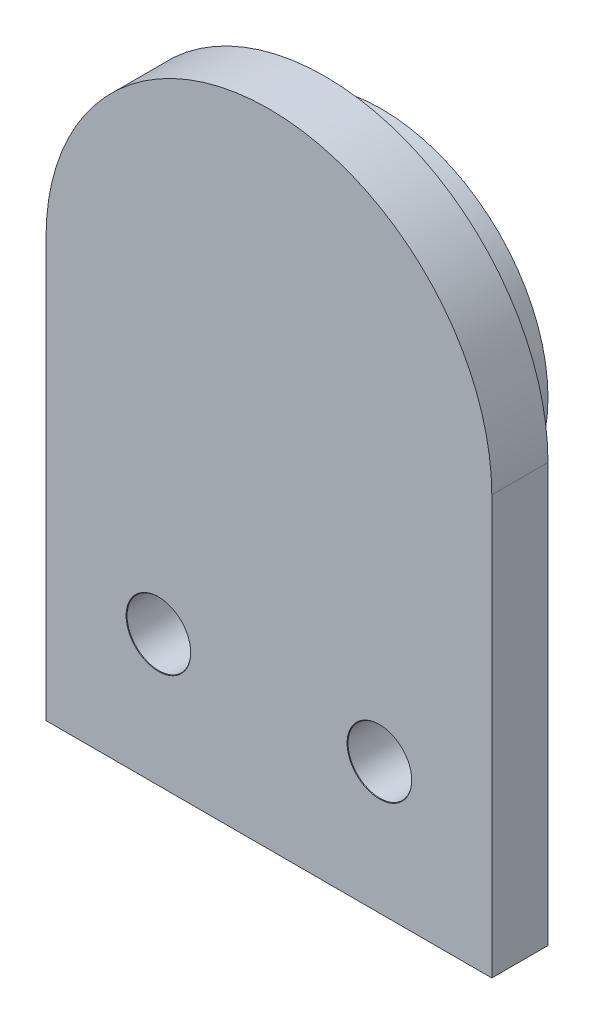
from build123d import *

# Parameters (mm, degrees)
BOSS_EXTRUDE1_DEPTH            = 3
SKETCH2_R                      = 8.9
BOSS_EXTRUDE2_DEPTH            = 3
SKETCH3_R                      = 2
BOSS_EXTRUDE3_DEPTH            = 3
M3_CLEARANCE_HOLE1_D           = 3.4
M3_CLEARANCE_HOLE1_CSINK_D     = 3.45
M3_CLEARANCE_HOLE1_CSINK_ANGLE = 90


with BuildPart() as part:
    # Sketch1 → Boss-Extrude1 (new body)
    with BuildSketch(Plane.XY):
        with BuildLine():
            Line((-11.9, 0), (-11.9, -22.34))
            Line((-11.9, -22.34), (11.9, -22.34))
            Line((11.9, -22.34), (11.9, 0))
            ThreePointArc((11.9, 0), (0, 11.9), (-11.9, 0))
        make_face()
    extrude(amount=BOSS_EXTRUDE1_DEPTH)

    # Sketch2 → Boss-Extrude2 (add)
    with BuildSketch(Plane(origin=(0, 0, 0), x_dir=(-1, 0, 0), z_dir=(0, 0, -1))):
        Circle(SKETCH2_R)
    extrude(amount=BOSS_EXTRUDE2_DEPTH)

    # Sketch3 → Boss-Extrude3 (add)
    with BuildSketch(Plane(origin=(0, 0, -3), x_dir=(-1, 0, 0), z_dir=(0, 0, -1))):
        Circle(SKETCH3_R)
    extrude(amount=BOSS_EXTRUDE3_DEPTH)

    # M3 Clearance Hole1 (through all)
    with Locations(Plane(origin=(-5.9, -15.34, 3), x_dir=(1, 0, 0), z_dir=(0, 0, 1))):
        with Locations((0, 0), (11.8, 0)):
            CounterSinkHole(M3_CLEARANCE_HOLE1_D / 2, M3_CLEARANCE_HOLE1_CSINK_D / 2, counter_sink_angle=M3_CLEARANCE_HOLE1_CSINK_ANGLE)


solid = part.part
